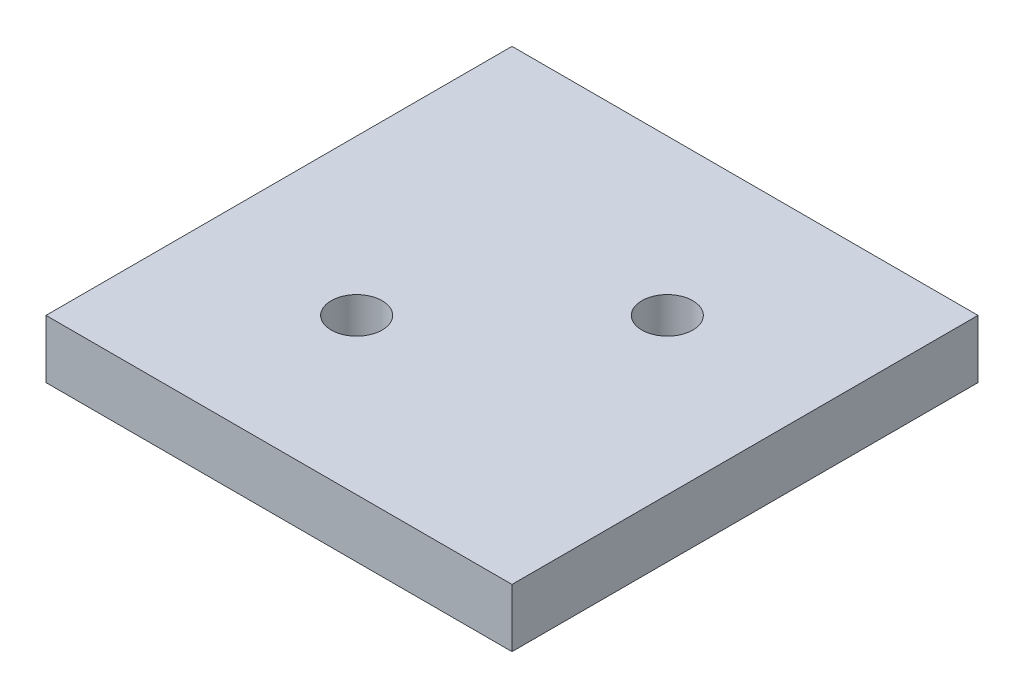
from build123d import *

# Parameters (mm, degrees)
SKETCH1_W           = 50.8
SKETCH1_H           = 50.8
SKETCH1_R           = 2.778125
BOSS_EXTRUDE1_DEPTH = 6.35


with BuildPart() as part:
    # Sketch1 → Boss-Extrude1 (new body)
    with BuildSketch(Plane(origin=(0, 0, 0), x_dir=(1, 0, 0), z_dir=(0, 1, 0))):
        with Locations((25.4, 25.4)):
            Rectangle(SKETCH1_W, SKETCH1_H)
        with Locations(Location((33.866666667, 33.866666667, 0), (0, 0, 270))):
            Circle(SKETCH1_R, mode=Mode.SUBTRACT)
        with Locations(Location((16.933333333, 16.933333333, 0), (0, 0, 270))):
            Circle(SKETCH1_R, mode=Mode.SUBTRACT)
    extrude(amount=-BOSS_EXTRUDE1_DEPTH)


solid = part.part
